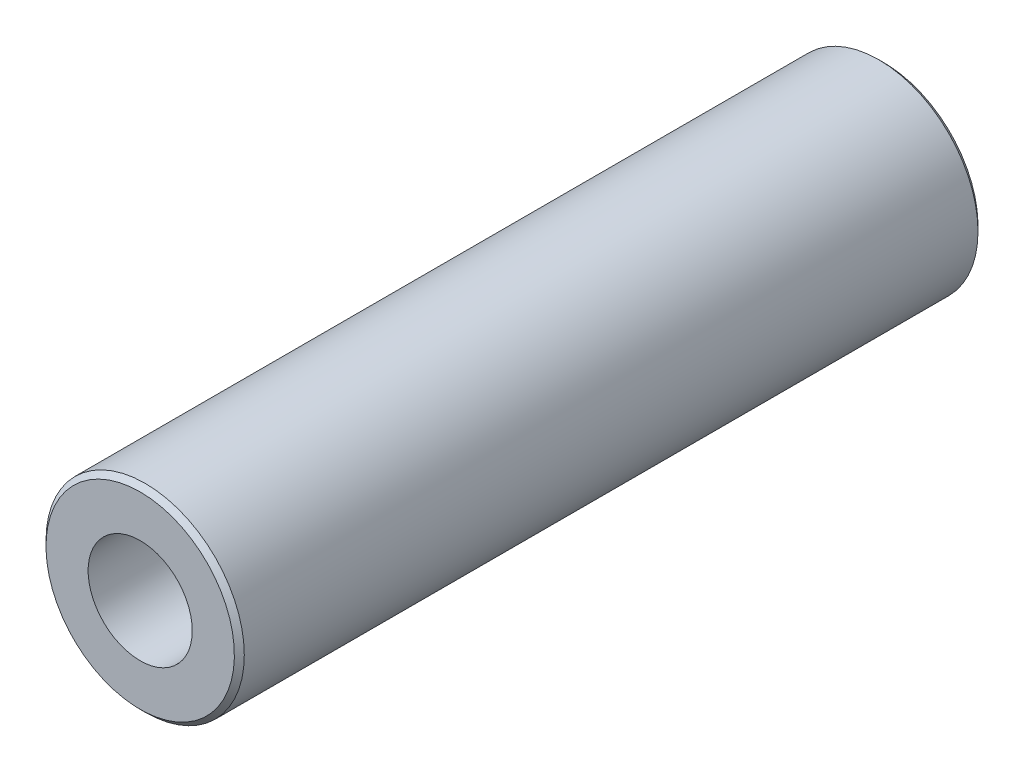
from build123d import *

# Parameters (mm, degrees)
SKETCH_1_W     = 30
SKETCH_1_H     = 4
CHAMFER_1_SIZE = 0.2


with BuildPart() as part:
    # 草图1 → 旋转1 (revolve)
    with BuildSketch(Plane(origin=(0, 0, 0), x_dir=(0, 0, -1), z_dir=(1, 0, 0)), mode=Mode.PRIVATE) as revolve_1_sk:
        with Locations((0, 2)):
            Rectangle(SKETCH_1_W, SKETCH_1_H)
    revolve(revolve_1_sk.sketch.rotate(Axis((0, 0, 15), (0, 0, -1)), 180), axis=Axis((0, 0, 15), (0, 0, -1)))

    # 草图3 → Hole Wizard 1 (revolve, cut)
    with BuildSketch(Plane(origin=(0, 0, 15), x_dir=(0, -1, 0), z_dir=(1, 0, 0))):
        Polygon((0, 0), (0, 14.7618073), (2.1, 13.5), (2.1, 0), align=None)
    hole_wizard_1 = revolve(axis=Axis((0, 0, 21.35), (0, 0, -1)), mode=Mode.SUBTRACT)

    # 镜向1: Hole Wizard 1 across plane
    add(hole_wizard_1.mirror(Plane.XY), mode=Mode.SUBTRACT)

    # 倒角1
    chamfer_1_edges = [part.edges().sort_by_distance(p)[0] for p in [
        (0, 4, -15),
        (0, 4, 15),
    ]]
    chamfer(chamfer_1_edges, length=CHAMFER_1_SIZE)


solid = part.part
